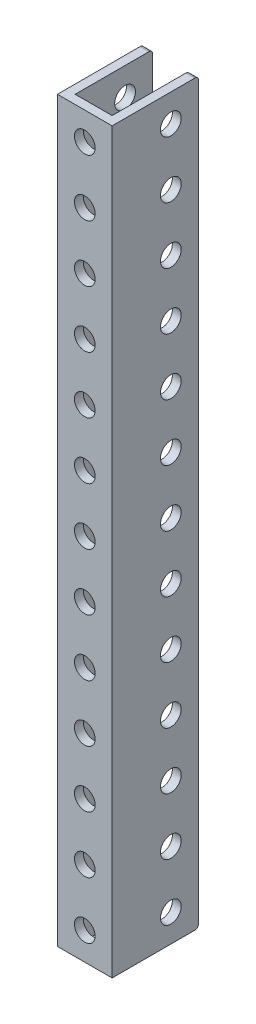
from build123d import *

# Parameters (mm, degrees)
SKETCH1_W                 = 126.873
SKETCH1_H                 = 14.859
BOSS_EXTRUDE1_DEPTH       = 9.398
SKETCH2_W                 = 6.35
SKETCH2_H                 = 13.335
CUT_EXTRUDE1_DEPTH        = 128.658375969
F_5_CLEARANCE_HOLE1_D     = 3.556
F_5_CLEARANCE_HOLE1_DEPTH = 1.524
F_5_CLEARANCE_HOLE2_D     = 3.556
F_5_CLEARANCE_HOLE2_DEPTH = 14.859
F_5_CLEARANCE_HOLE3_D     = 3.556
FILLET1_R                 = 0.635


with BuildPart() as part:
    # Sketch1 → Boss-Extrude1 (new body)
    with BuildSketch(Plane(origin=(-4.699, 0, 0), x_dir=(0, -1, 0), z_dir=(-1, 0, 0))):
        with Locations((-63.4365, -5.9055)):
            Rectangle(SKETCH1_W, SKETCH1_H)
    extrude(amount=-BOSS_EXTRUDE1_DEPTH)

    # Sketch2 → Cut-Extrude1 (cut, through all)
    with BuildSketch(Plane.XZ):
        with Locations((0, -6.6675)):
            Rectangle(SKETCH2_W, SKETCH2_H)
    extrude(amount=-CUT_EXTRUDE1_DEPTH, mode=Mode.SUBTRACT)

    # #5 Clearance Hole1
    with Locations(Plane(origin=(4.699, 0, 0), x_dir=(0, 0, -1), z_dir=(1, 0, 0))):
        with Locations((8.5725, 112.3315), (8.5725, 122.1105), (8.5725, 102.5525), (8.5725, 92.7735), (8.5725, 82.9945), (8.5725, 73.2155), (8.5725, 63.4365), (8.5725, 53.6575), (8.5725, 43.8785), (8.5725, 34.0995), (8.5725, 24.3205), (8.5725, 14.5415), (8.5725, 4.7625)):
            Hole(F_5_CLEARANCE_HOLE1_D / 2, depth=F_5_CLEARANCE_HOLE1_DEPTH)

    # #5 Clearance Hole2
    with Locations(Plane.XY.offset(1.524)):
        with Locations((0, 112.3315), (0, 122.1105), (0, 102.5525), (0, 92.7735), (0, 82.9945), (0, 73.2155), (0, 63.4365), (0, 53.6575), (0, 43.8785), (0, 34.0995), (0, 24.3205), (0, 14.5415), (0, 4.7625)):
            Hole(F_5_CLEARANCE_HOLE2_D / 2, depth=F_5_CLEARANCE_HOLE2_DEPTH)

    # #5 Clearance Hole3 (through all)
    with Locations(Plane(origin=(-3.175, 0, 0), x_dir=(0, 0, -1), z_dir=(1, 0, 0))):
        with Locations((8.5725, 112.3315), (8.5725, 122.1105), (8.5725, 102.5525), (8.5725, 92.7735), (8.5725, 82.9945), (8.5725, 73.2155), (8.5725, 63.4365), (8.5725, 53.6575), (8.5725, 43.8785), (8.5725, 34.0995), (8.5725, 24.3205), (8.5725, 14.5415), (8.5725, 4.7625)):
            Hole(F_5_CLEARANCE_HOLE3_D / 2)

    # Fillet1
    fillet1_edges = [part.edges().sort_by_distance(p)[0] for p in [
        (-3.937, 126.873, -13.335),
        (-3.937, 0, -13.335),
        (3.937, 0, -13.335),
        (3.937, 126.873, -13.335),
    ]]
    fillet(fillet1_edges, radius=FILLET1_R)


solid = part.part
